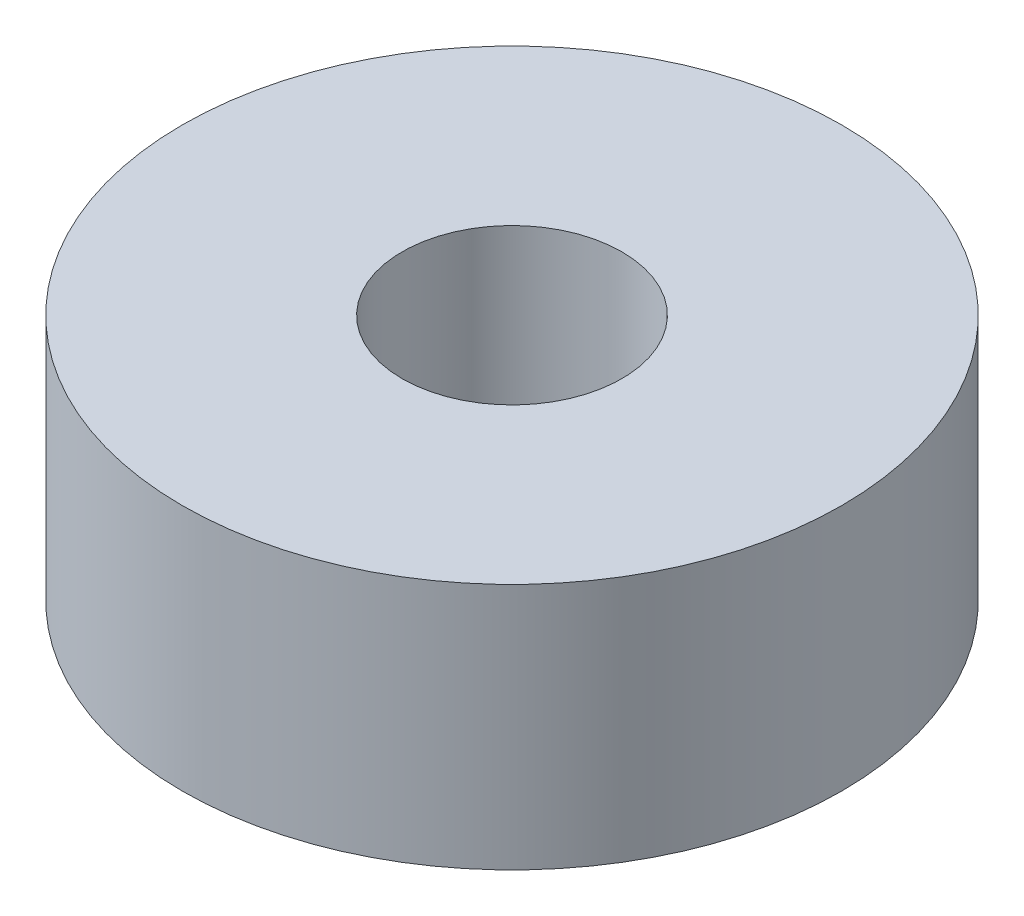
from build123d import *

# Parameters (mm, degrees)
CROQUIS1_R              = 12
CROQUIS1_R_2            = 4
SALIENTE_EXTRUIR1_DEPTH = 9


with BuildPart() as part:
    # Croquis1 → Saliente-Extruir1 (new body)
    with BuildSketch(Plane(origin=(0, 0, 0), x_dir=(1, 0, 0), z_dir=(0, 1, 0))):
        with Locations(Location((0, 0, 0), (0, 0, 270))):
            Circle(CROQUIS1_R)
        with Locations(Location((0, 0, 0), (0, 0, 270))):
            Circle(CROQUIS1_R_2, mode=Mode.SUBTRACT)
    extrude(amount=SALIENTE_EXTRUIR1_DEPTH)


solid = part.part
